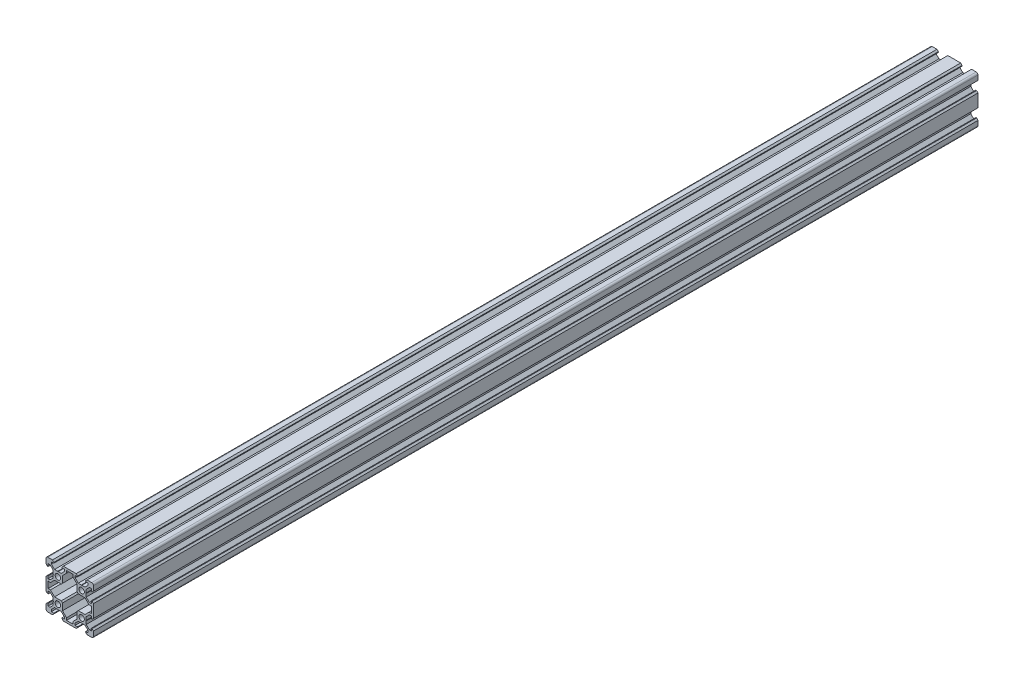
from build123d import *

# Parameters (mm, degrees)
SKETCH1_R           = 2.3
BOSS_EXTRUDE1_DEPTH = 745


with BuildPart() as part:
    # Sketch1 → Boss-Extrude1 (new body)
    with BuildSketch(Plane.XY):
        with BuildLine():
            Line((14.271948898, -9.838051102), (14.061948898, -9.628051102))
            Line((14.061948898, -9.628051102), (14.271948898, -9.418051102))
            Line((14.271948898, -9.418051102), (14.271948898, -6.788711274))
            Line((14.271948898, -6.788711274), (16.932609069, -4.128051102))
            Line((16.932609069, -4.128051102), (18.571948898, -4.128051102))
            Line((18.571948898, -4.128051102), (18.571948898, -6.233051102))
            Line((18.571948898, -6.233051102), (19.186948898, -6.233051102))
            Line((19.186948898, -6.233051102), (20.371948898, -5.048051102))
            Line((20.371948898, -5.048051102), (20.371948898, 5.791948898))
            Line((20.371948898, 5.791948898), (19.186948898, 6.976948898))
            Line((19.186948898, 6.976948898), (18.571948898, 6.976948898))
            Line((18.571948898, 6.976948898), (18.571948898, 4.871948898))
            Line((18.571948898, 4.871948898), (16.932609069, 4.871948898))
            Line((16.932609069, 4.871948898), (14.271948898, 7.532609069))
            Line((14.271948898, 7.532609069), (14.271948898, 10.161948898))
            Line((14.271948898, 10.161948898), (14.061948898, 10.371948898))
            Line((14.061948898, 10.371948898), (14.271948898, 10.581948898))
            Line((14.271948898, 10.581948898), (14.271948898, 13.211288726))
            Line((14.271948898, 13.211288726), (16.932609069, 15.871948898))
            Line((16.932609069, 15.871948898), (18.571948898, 15.871948898))
            Line((18.571948898, 15.871948898), (18.571948898, 13.766948898))
            Line((18.571948898, 13.766948898), (19.186948898, 13.766948898))
            Line((19.186948898, 13.766948898), (20.371948898, 14.951948898))
            Line((20.371948898, 14.951948898), (20.371948898, 18.871948898))
            ThreePointArc((20.371948898, 18.871948898), (19.932609069, 19.932609069), (18.871948898, 20.371948898))
            Line((18.871948898, 20.371948898), (14.951948898, 20.371948898))
            Line((14.951948898, 20.371948898), (13.766948898, 19.186948898))
            Line((13.766948898, 19.186948898), (13.766948898, 18.571948898))
            Line((13.766948898, 18.571948898), (15.871948898, 18.571948898))
            Line((15.871948898, 18.571948898), (15.871948898, 16.932609069))
            Line((15.871948898, 16.932609069), (13.211288726, 14.271948898))
            Line((13.211288726, 14.271948898), (10.581948898, 14.271948898))
            Line((10.581948898, 14.271948898), (10.371948898, 14.061948898))
            Line((10.371948898, 14.061948898), (10.161948898, 14.271948898))
            Line((10.161948898, 14.271948898), (7.532609069, 14.271948898))
            Line((7.532609069, 14.271948898), (4.871948898, 16.932609069))
            Line((4.871948898, 16.932609069), (4.871948898, 18.571948898))
            Line((4.871948898, 18.571948898), (6.976948898, 18.571948898))
            Line((6.976948898, 18.571948898), (6.976948898, 19.186948898))
            Line((6.976948898, 19.186948898), (5.791948898, 20.371948898))
            Line((5.791948898, 20.371948898), (-5.048051102, 20.371948898))
            Line((-5.048051102, 20.371948898), (-6.233051102, 19.186948898))
            Line((-6.233051102, 19.186948898), (-6.233051102, 18.571948898))
            Line((-6.233051102, 18.571948898), (-4.128051102, 18.571948898))
            Line((-4.128051102, 18.571948898), (-4.128051102, 16.932609069))
            Line((-4.128051102, 16.932609069), (-6.788711274, 14.271948898))
            Line((-6.788711274, 14.271948898), (-9.418051102, 14.271948898))
            Line((-9.418051102, 14.271948898), (-9.628051102, 14.061948898))
            Line((-9.628051102, 14.061948898), (-9.838051102, 14.271948898))
            Line((-9.838051102, 14.271948898), (-12.467390931, 14.271948898))
            Line((-12.467390931, 14.271948898), (-15.128051102, 16.932609069))
            Line((-15.128051102, 16.932609069), (-15.128051102, 18.571948898))
            Line((-15.128051102, 18.571948898), (-13.023051102, 18.571948898))
            Line((-13.023051102, 18.571948898), (-13.023051102, 19.186948898))
            Line((-13.023051102, 19.186948898), (-14.208051102, 20.371948898))
            Line((-14.208051102, 20.371948898), (-18.128051102, 20.371948898))
            ThreePointArc((-18.128051102, 20.371948898), (-19.188711274, 19.932609069), (-19.628051102, 18.871948898))
            Line((-19.628051102, 18.871948898), (-19.628051102, 14.951948898))
            Line((-19.628051102, 14.951948898), (-18.443051102, 13.766948898))
            Line((-18.443051102, 13.766948898), (-17.828051102, 13.766948898))
            Line((-17.828051102, 13.766948898), (-17.828051102, 15.871948898))
            Line((-17.828051102, 15.871948898), (-16.188711274, 15.871948898))
            Line((-16.188711274, 15.871948898), (-13.528051102, 13.211288726))
            Line((-13.528051102, 13.211288726), (-13.528051102, 10.581948898))
            Line((-13.528051102, 10.581948898), (-13.318051102, 10.371948898))
            Line((-13.318051102, 10.371948898), (-13.528051102, 10.161948898))
            Line((-13.528051102, 10.161948898), (-13.528051102, 7.532609069))
            Line((-13.528051102, 7.532609069), (-16.188711274, 4.871948898))
            Line((-16.188711274, 4.871948898), (-17.828051102, 4.871948898))
            Line((-17.828051102, 4.871948898), (-17.828051102, 6.976948898))
            Line((-17.828051102, 6.976948898), (-18.443051102, 6.976948898))
            Line((-18.443051102, 6.976948898), (-19.628051102, 5.791948898))
            Line((-19.628051102, 5.791948898), (-19.628051102, -5.048051102))
            Line((-19.628051102, -5.048051102), (-18.443051102, -6.233051102))
            Line((-18.443051102, -6.233051102), (-17.828051102, -6.233051102))
            Line((-17.828051102, -6.233051102), (-17.828051102, -4.128051102))
            Line((-17.828051102, -4.128051102), (-16.188711274, -4.128051102))
            Line((-16.188711274, -4.128051102), (-13.528051102, -6.788711274))
            Line((-13.528051102, -6.788711274), (-13.528051102, -9.418051102))
            Line((-13.528051102, -9.418051102), (-13.318051102, -9.628051102))
            Line((-13.318051102, -9.628051102), (-13.528051102, -9.838051102))
            Line((-13.528051102, -9.838051102), (-13.528051102, -12.467390931))
            Line((-13.528051102, -12.467390931), (-16.188711274, -15.128051102))
            Line((-16.188711274, -15.128051102), (-17.828051102, -15.128051102))
            Line((-17.828051102, -15.128051102), (-17.828051102, -13.023051102))
            Line((-17.828051102, -13.023051102), (-18.443051102, -13.023051102))
            Line((-18.443051102, -13.023051102), (-19.628051102, -14.208051102))
            Line((-19.628051102, -14.208051102), (-19.628051102, -18.128051102))
            ThreePointArc((-19.628051102, -18.128051102), (-19.188711274, -19.188711274), (-18.128051102, -19.628051102))
            Line((-18.128051102, -19.628051102), (-14.208051102, -19.628051102))
            Line((-14.208051102, -19.628051102), (-13.023051102, -18.443051102))
            Line((-13.023051102, -18.443051102), (-13.023051102, -17.828051102))
            Line((-13.023051102, -17.828051102), (-15.128051102, -17.828051102))
            Line((-15.128051102, -17.828051102), (-15.128051102, -16.188711274))
            Line((-15.128051102, -16.188711274), (-12.467390931, -13.528051102))
            Line((-12.467390931, -13.528051102), (-9.838051102, -13.528051102))
            Line((-9.838051102, -13.528051102), (-9.628051102, -13.318051102))
            Line((-9.628051102, -13.318051102), (-9.418051102, -13.528051102))
            Line((-9.418051102, -13.528051102), (-6.788711274, -13.528051102))
            Line((-6.788711274, -13.528051102), (-4.128051102, -16.188711274))
            Line((-4.128051102, -16.188711274), (-4.128051102, -17.828051102))
            Line((-4.128051102, -17.828051102), (-6.233051102, -17.828051102))
            Line((-6.233051102, -17.828051102), (-6.233051102, -18.443051102))
            Line((-6.233051102, -18.443051102), (-5.048051102, -19.628051102))
            Line((-5.048051102, -19.628051102), (5.791948898, -19.628051102))
            Line((5.791948898, -19.628051102), (6.976948898, -18.443051102))
            Line((6.976948898, -18.443051102), (6.976948898, -17.828051102))
            Line((6.976948898, -17.828051102), (4.871948898, -17.828051102))
            Line((4.871948898, -17.828051102), (4.871948898, -16.188711274))
            Line((4.871948898, -16.188711274), (7.532609069, -13.528051102))
            Line((7.532609069, -13.528051102), (10.161948898, -13.528051102))
            Line((10.161948898, -13.528051102), (10.371948898, -13.318051102))
            Line((10.371948898, -13.318051102), (10.581948898, -13.528051102))
            Line((10.581948898, -13.528051102), (13.211288726, -13.528051102))
            Line((13.211288726, -13.528051102), (15.871948898, -16.188711274))
            Line((15.871948898, -16.188711274), (15.871948898, -17.828051102))
            Line((15.871948898, -17.828051102), (13.766948898, -17.828051102))
            Line((13.766948898, -17.828051102), (13.766948898, -18.443051102))
            Line((13.766948898, -18.443051102), (14.951948898, -19.628051102))
            Line((14.951948898, -19.628051102), (18.871948898, -19.628051102))
            ThreePointArc((18.871948898, -19.628051102), (19.932609069, -19.188711274), (20.371948898, -18.128051102))
            Line((20.371948898, -18.128051102), (20.371948898, -14.208051102))
            Line((20.371948898, -14.208051102), (19.186948898, -13.023051102))
            Line((19.186948898, -13.023051102), (18.571948898, -13.023051102))
            Line((18.571948898, -13.023051102), (18.571948898, -15.128051102))
            Line((18.571948898, -15.128051102), (16.932609069, -15.128051102))
            Line((16.932609069, -15.128051102), (14.271948898, -12.467390931))
            Line((14.271948898, -12.467390931), (14.271948898, -9.838051102))
        make_face()
        with Locations((-9.628051102, -9.628051102)):
            Circle(SKETCH1_R, mode=Mode.SUBTRACT)
        with Locations((10.371948898, -9.628051102)):
            Circle(SKETCH1_R, mode=Mode.SUBTRACT)
        with Locations((10.371948898, 10.371948898)):
            Circle(SKETCH1_R, mode=Mode.SUBTRACT)
        with Locations((-9.628051102, 10.371948898)):
            Circle(SKETCH1_R, mode=Mode.SUBTRACT)
        Polygon((-12.467390931, 6.471948898), (-6.788711274, 6.471948898), (-5.728051102, 7.532609069), (-5.728051102, 13.211288726), (-2.328051102, 16.611288726), (-2.328051102, 18.571948898), (3.071948898, 18.571948898), (3.071948898, 16.611288726), (6.471948898, 13.211288726), (6.471948898, 7.532609069), (7.532609069, 6.471948898), (13.211288726, 6.471948898), (16.611288726, 3.071948898), (18.571948898, 3.071948898), (18.571948898, -2.328051102), (16.611288726, -2.328051102), (13.211288726, -5.728051102), (7.532609069, -5.728051102), (6.471948898, -6.788711274), (6.471948898, -12.467390931), (3.071948898, -15.867390931), (3.071948898, -17.828051102), (-2.328051102, -17.828051102), (-2.328051102, -15.867390931), (-5.728051102, -12.467390931), (-5.728051102, -6.788711274), (-6.788711274, -5.728051102), (-12.467390931, -5.728051102), (-15.867390931, -2.328051102), (-17.828051102, -2.328051102), (-17.828051102, 3.071948898), (-15.867390931, 3.071948898), align=None, mode=Mode.SUBTRACT)
    extrude(amount=BOSS_EXTRUDE1_DEPTH)


solid = part.part
